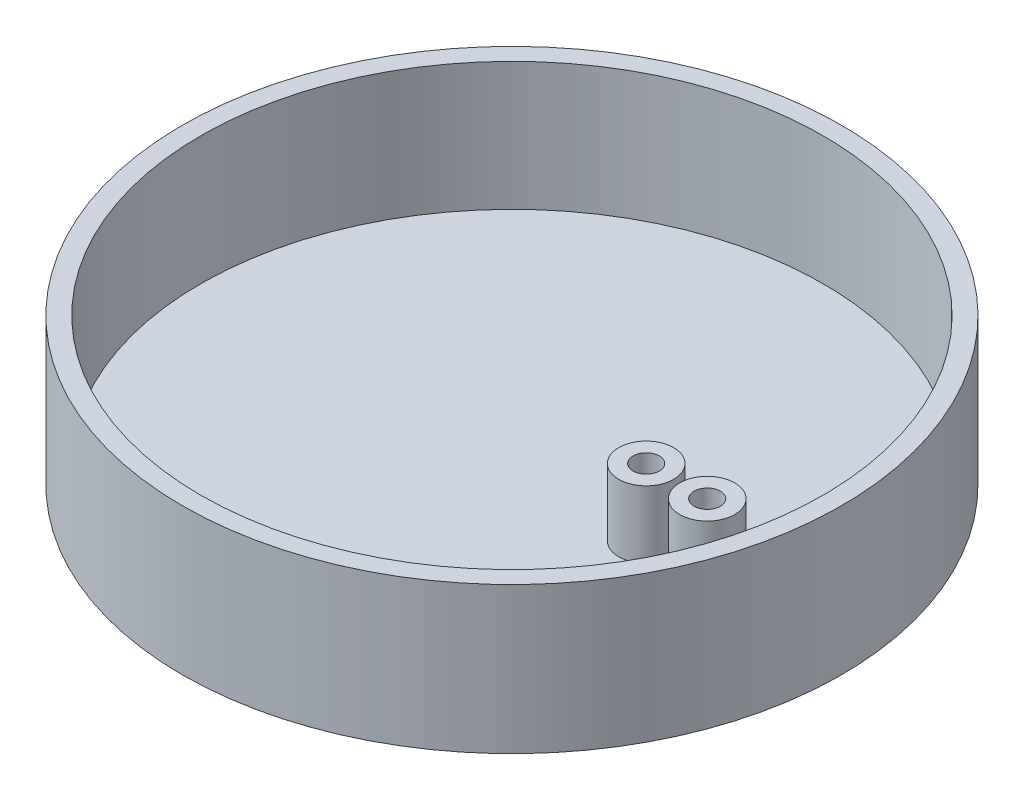
from build123d import *

# Parameters (mm, degrees)
SKETCH_1_R                     = 54
FLOOR_D108_T3_DEPTH            = 3
SKETCH_2_R                     = 54
SKETCH_2_R_2                   = 51
RIM_OD108_ID102_H24_DEPTH      = 24
SKETCH_3_R                     = 4.5
SENSOR_FIXED_POSTS_DEPTH       = 14
SKETCH_4_R                     = 2.15
M4_FIXED_MOUNT_CLEARANCE_DEPTH = 14


with BuildPart() as part:
    # 草图1 → Floor_D108_T3 (new body)
    with BuildSketch(Plane(origin=(0, 0, 0), x_dir=(1, 0, 0), z_dir=(0, 1, 0))):
        with Locations(Location((0, 0, 0), (0, 0, 270))):
            Circle(SKETCH_1_R)
    extrude(amount=FLOOR_D108_T3_DEPTH)

    # 草图2 → Rim_OD108_ID102_H24 (add)
    with BuildSketch(Plane(origin=(0, 0, 0), x_dir=(1, 0, 0), z_dir=(0, 1, 0))):
        with Locations(Location((0, 0, 0), (0, 0, 270))):
            Circle(SKETCH_2_R)
        with Locations(Location((0, 0, 0), (0, 0, 270))):
            Circle(SKETCH_2_R_2, mode=Mode.SUBTRACT)
    extrude(amount=RIM_OD108_ID102_H24_DEPTH)

    # 草图3 → Sensor_fixed_posts (add)
    with BuildSketch(Plane(origin=(0, 0, 0), x_dir=(1, 0, 0), z_dir=(0, 1, 0))):
        with Locations(Location((22, 0, 0), (0, 0, 270))):
            Circle(SKETCH_3_R)
        with Locations(Location((32, 0, 0), (0, 0, 270))):
            Circle(SKETCH_3_R)
    extrude(amount=SENSOR_FIXED_POSTS_DEPTH)

    # 草图4 → M4_fixed_mount_clearance (cut)
    with BuildSketch(Plane(origin=(0, 0, 0), x_dir=(1, 0, 0), z_dir=(0, 1, 0))):
        with Locations(Location((22, 0, 0), (0, 0, 270))):
            Circle(SKETCH_4_R)
        with Locations(Location((32, 0, 0), (0, 0, 270))):
            Circle(SKETCH_4_R)
    extrude(amount=M4_FIXED_MOUNT_CLEARANCE_DEPTH, mode=Mode.SUBTRACT)


solid = part.part
